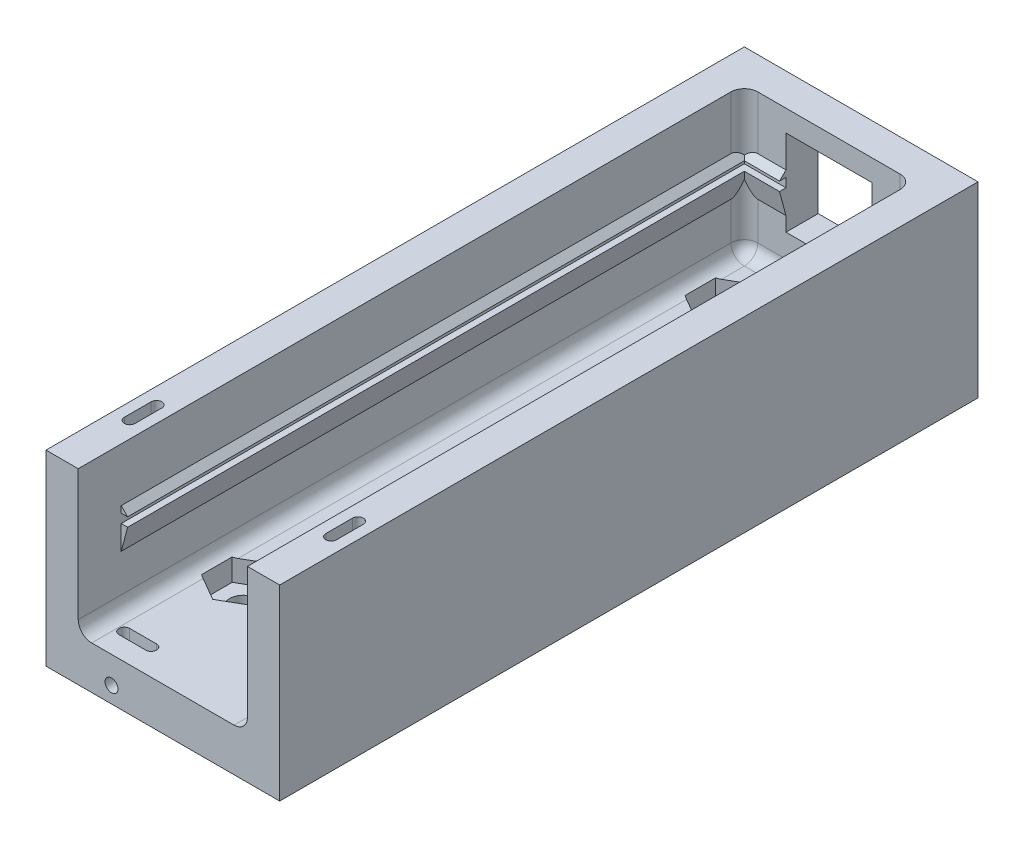
from build123d import *

# Parameters (mm, degrees)
BOSS_EXTRUDE1_DEPTH            = 82.55
BOSS_EXTRUDE2_START            = -5.08
BOSS_EXTRUDE2_DEPTH            = 77.47
BOSS_EXTRUDE4_REACH            = 89.467
SKETCH8_W                      = 27.6225
SKETCH8_H                      = 3.81
BOSS_EXTRUDE5_REACH            = 88.945
CUT_EXTRUDE1_REACH             = 86.753
SKETCH10_W                     = 10.16
SKETCH10_H                     = 10.16
SKETCH11_W                     = 27.6225
SKETCH11_H                     = 3.2766
CUT_EXTRUDE2_DEPTH             = 85.753025619
FILLET3_R                      = 1.5875
CUT_EXTRUDE3_DEPTH             = 2.286
CUT_EXTRUDE4_DEPTH             = 3.175
F_4_CLEARANCE_HOLE1_D          = 3.2639
CUT_EXTRUDE5_DEPTH             = 2.54
CUT_EXTRUDE5_DIRECTION_2_REACH = 87.415
SKETCH18_R                     = 0.762
CUT_EXTRUDE6_DEPTH             = 10.16


with BuildPart() as part:
    # Sketch1 → Boss-Extrude1 (new body)
    with BuildSketch(Plane.XY):
        Polygon((10.00125, 12.065), (10.00125, -8.255), (-10.00125, -8.255), (-10.00125, 12.065), (-13.81125, 12.065), (-13.81125, -13.335), (13.81125, -13.335), (13.81125, 12.065), align=None)
    extrude(amount=BOSS_EXTRUDE1_DEPTH)

    # Sketch3 → Boss-Extrude2 (add)
    with BuildSketch(Plane.XY.offset(82.55).offset(BOSS_EXTRUDE2_START)):
        Polygon((10.00125, 1.7018), (9.23925, 1.7018), (10.00125, 2.4638), align=None)
        Polygon((10.00125, 0.635), (9.23925, 0.635), (10.00125, -2.208822715), align=None)
        Polygon((-10.00125, 2.4638), (-10.00125, 1.7018), (-9.23925, 1.7018), align=None)
        Polygon((-10.00125, -2.208822715), (-10.00125, 0.635), (-9.23925, 0.635), align=None)
    extrude(amount=-BOSS_EXTRUDE2_DEPTH)

    # Boss-Extrude4: up to this face of the body (flat: up to its plane)
    boss_extrude4_end = Plane(part.part.faces().sort_by_distance((0, -8.255, 41.275))[0])
    # Sketch8 → Boss-Extrude4 (add, up to the picked face)
    with BuildSketch(Plane(origin=(0, 12.065, 0), x_dir=(1, 0, 0), z_dir=(0, 1, 0)), mode=Mode.PRIVATE) as boss_extrude4_sk1:
        with Locations((0, -1.905)):
            Rectangle(SKETCH8_W, SKETCH8_H)
    boss_extrude4_tool1 = split(extrude(boss_extrude4_sk1.sketch, amount=-BOSS_EXTRUDE4_REACH, mode=Mode.PRIVATE), bisect_by=boss_extrude4_end, keep=Keep.BOTH, mode=Mode.PRIVATE)
    add(boss_extrude4_tool1.solids().sort_by(Axis((0, 12.065, 1.905), (0, -1, 0)))[0])

    # Boss-Extrude5: up to this face of the body (flat: up to its plane)
    boss_extrude5_end = Plane(part.part.faces().sort_by_distance((10.00125, 7.2644, 4.623196778))[0])
    # Sketch9 → Boss-Extrude5 (add, up to the picked face)
    with BuildSketch(Plane(origin=(-10.00125, 0, 0), x_dir=(0, 0, -1), z_dir=(1, 0, 0)), mode=Mode.PRIVATE) as boss_extrude5_sk1:
        Polygon((-3.81, 2.4638), (-3.81, 1.7018), (-4.572, 1.7018), align=None)
    boss_extrude5_tool1 = split(extrude(boss_extrude5_sk1.sketch, amount=BOSS_EXTRUDE5_REACH, mode=Mode.PRIVATE), bisect_by=boss_extrude5_end, keep=Keep.BOTH, mode=Mode.PRIVATE)
    # Sketch9 → Boss-Extrude5 (add, up to the picked face)
    with BuildSketch(Plane(origin=(-10.00125, 0, 0), x_dir=(0, 0, -1), z_dir=(1, 0, 0)), mode=Mode.PRIVATE) as boss_extrude5_sk2:
        Polygon((-3.81, 0.635), (-3.81, -2.208822715), (-4.572, 0.635), align=None)
    boss_extrude5_tool2 = split(extrude(boss_extrude5_sk2.sketch, amount=BOSS_EXTRUDE5_REACH, mode=Mode.PRIVATE), bisect_by=boss_extrude5_end, keep=Keep.BOTH, mode=Mode.PRIVATE)
    add(boss_extrude5_tool1.solids().sort_by(Axis((-10.00125, 1.9558, 4.064), (1, 0, 0)))[0])
    add(boss_extrude5_tool2.solids().sort_by(Axis((-10.00125, -0.312941, 4.064), (1, 0, 0)))[0])

    # Sketch10 → Cut-Extrude1 (cut, up to next)
    with BuildSketch(Plane(origin=(0, 0, 0), x_dir=(-1, 0, 0), z_dir=(0, 0, -1)), mode=Mode.PRIVATE) as cut_extrude1_sk1:
        with Locations((0, 1.1684)):
            Rectangle(SKETCH10_W, SKETCH10_H)
    cut_extrude1_tool1 = extrude(cut_extrude1_sk1.sketch, amount=-CUT_EXTRUDE1_REACH, mode=Mode.PRIVATE) & part.part
    add(cut_extrude1_tool1.solids().sort_by_distance((0, 1.1684, 0))[0], mode=Mode.SUBTRACT)

    # Sketch11 → Cut-Extrude2 (cut, through all)
    with BuildSketch(Plane.XY.offset(82.55)):
        with Locations((0, 10.4267)):
            Rectangle(SKETCH11_W, SKETCH11_H)
    extrude(amount=-CUT_EXTRUDE2_DEPTH, mode=Mode.SUBTRACT)

    # Fillet3
    fillet3_edges = [part.edges().sort_by_distance(p)[0] for p in [
        (-10.00125, -8.255, 43.18),
        (10.00125, -8.255, 43.18),
        (10.00125, 5.6261, 3.81),
        (0, -8.255, 3.81),
        (10.00125, -5.231911358, 3.81),
        (-10.00125, 5.6261, 3.81),
        (-10.00125, -5.231911358, 3.81),
    ]]
    fillet(fillet3_edges, radius=FILLET3_R)

    # Sketch13 → Cut-Extrude3 (cut)
    with BuildSketch(Plane(origin=(0, -8.255, 0), x_dir=(1, 0, 0), z_dir=(0, 1, 0))):
        with BuildLine():
            Line((-7.651886934, -78.8162), (-4.476886934, -78.8162))
            ThreePointArc((-4.476886934, -78.8162), (-3.841886934, -79.4512), (-4.476886934, -80.0862))
            Line((-4.476886934, -80.0862), (-7.651886934, -80.0862))
            ThreePointArc((-7.651886934, -80.0862), (-8.286886934, -79.4512), (-7.651886934, -78.8162))
        make_face()
    extrude(amount=-CUT_EXTRUDE3_DEPTH, mode=Mode.SUBTRACT)

    # Sketch14 → Cut-Extrude4 (cut)
    with BuildSketch(Plane(origin=(0, 8.7884, 0), x_dir=(1, 0, 0), z_dir=(0, 1, 0))):
        with BuildLine():
            Line((-11.27125, -71.386954), (-11.27125, -74.561954))
            ThreePointArc((-11.27125, -74.561954), (-11.90625, -75.196954), (-12.54125, -74.561954))
            Line((-12.54125, -74.561954), (-12.54125, -71.386954))
            ThreePointArc((-12.54125, -71.386954), (-11.90625, -70.751954), (-11.27125, -71.386954))
        make_face()
        with BuildLine():
            Line((11.27125, -71.386954), (11.27125, -74.561954))
            ThreePointArc((11.27125, -74.561954), (11.90625, -75.196954), (12.54125, -74.561954))
            Line((12.54125, -74.561954), (12.54125, -71.386954))
            ThreePointArc((12.54125, -71.386954), (11.90625, -70.751954), (11.27125, -71.386954))
        make_face()
    extrude(amount=-CUT_EXTRUDE4_DEPTH, mode=Mode.SUBTRACT)

    # #4 Clearance Hole1 (through all)
    with Locations(Plane(origin=(0, -8.255, 0), x_dir=(1, 0, 0), z_dir=(0, 1, 0))):
        with Locations((-5.715, -10.16), (5.715, -67.31), (-5.715, -67.31), (5.715, -10.16)):
            Hole(F_4_CLEARANCE_HOLE1_D / 2)

    # Sketch17 → Cut-Extrude5 (cut)
    with BuildSketch(Plane(origin=(0, -8.255, 0), x_dir=(1, 0, 0), z_dir=(0, 1, 0))):
        Polygon((-5.715, -13.782180119), (-2.5781, -11.971090059), (-2.5781, -8.348909941), (-5.715, -6.537819881), (-8.8519, -8.348909941), (-8.8519, -11.971090059), align=None)
        Polygon((5.715, -13.782180119), (8.8519, -11.971090059), (8.8519, -8.348909941), (5.715, -6.537819881), (2.5781, -8.348909941), (2.5781, -11.971090059), align=None)
        Polygon((-5.715, -63.687819881), (-8.8519, -65.498909941), (-8.8519, -69.121090059), (-5.715, -70.932180119), (-2.5781, -69.121090059), (-2.5781, -65.498909941), align=None)
        Polygon((5.715, -63.687819881), (2.5781, -65.498909941), (2.5781, -69.121090059), (5.715, -70.932180119), (8.8519, -69.121090059), (8.8519, -65.498909941), align=None)
    extrude(amount=-CUT_EXTRUDE5_DEPTH, mode=Mode.SUBTRACT)

    # Sketch17 → Cut-Extrude5 direction 2 (cut, up to next)
    with BuildSketch(Plane(origin=(0, -8.255, 0), x_dir=(1, 0, 0), z_dir=(0, 1, 0)), mode=Mode.PRIVATE) as cut_extrude5_direction_2_sk1:
        Polygon((-5.715, -13.782180119), (-2.5781, -11.971090059), (-2.5781, -8.348909941), (-5.715, -6.537819881), (-8.8519, -8.348909941), (-8.8519, -11.971090059), align=None)
    cut_extrude5_direction_2_tool1 = extrude(cut_extrude5_direction_2_sk1.sketch, amount=CUT_EXTRUDE5_DIRECTION_2_REACH, mode=Mode.PRIVATE) & part.part
    # Sketch17 → Cut-Extrude5 direction 2 (cut, up to next)
    with BuildSketch(Plane(origin=(0, -8.255, 0), x_dir=(1, 0, 0), z_dir=(0, 1, 0)), mode=Mode.PRIVATE) as cut_extrude5_direction_2_sk2:
        Polygon((5.715, -13.782180119), (8.8519, -11.971090059), (8.8519, -8.348909941), (5.715, -6.537819881), (2.5781, -8.348909941), (2.5781, -11.971090059), align=None)
    cut_extrude5_direction_2_tool2 = extrude(cut_extrude5_direction_2_sk2.sketch, amount=CUT_EXTRUDE5_DIRECTION_2_REACH, mode=Mode.PRIVATE) & part.part
    # Sketch17 → Cut-Extrude5 direction 2 (cut, up to next)
    with BuildSketch(Plane(origin=(0, -8.255, 0), x_dir=(1, 0, 0), z_dir=(0, 1, 0)), mode=Mode.PRIVATE) as cut_extrude5_direction_2_sk3:
        Polygon((-5.715, -63.687819881), (-8.8519, -65.498909941), (-8.8519, -69.121090059), (-5.715, -70.932180119), (-2.5781, -69.121090059), (-2.5781, -65.498909941), align=None)
    cut_extrude5_direction_2_tool3 = extrude(cut_extrude5_direction_2_sk3.sketch, amount=CUT_EXTRUDE5_DIRECTION_2_REACH, mode=Mode.PRIVATE) & part.part
    # Sketch17 → Cut-Extrude5 direction 2 (cut, up to next)
    with BuildSketch(Plane(origin=(0, -8.255, 0), x_dir=(1, 0, 0), z_dir=(0, 1, 0)), mode=Mode.PRIVATE) as cut_extrude5_direction_2_sk4:
        Polygon((5.715, -63.687819881), (2.5781, -65.498909941), (2.5781, -69.121090059), (5.715, -70.932180119), (8.8519, -69.121090059), (8.8519, -65.498909941), align=None)
    cut_extrude5_direction_2_tool4 = extrude(cut_extrude5_direction_2_sk4.sketch, amount=CUT_EXTRUDE5_DIRECTION_2_REACH, mode=Mode.PRIVATE) & part.part
    add(cut_extrude5_direction_2_tool1.solids().sort_by_distance((-5.715, -8.255, 10.16))[0], mode=Mode.SUBTRACT)
    add(cut_extrude5_direction_2_tool2.solids().sort_by_distance((5.715, -8.255, 10.16))[0], mode=Mode.SUBTRACT)
    add(cut_extrude5_direction_2_tool3.solids().sort_by_distance((-5.715, -8.255, 67.31))[0], mode=Mode.SUBTRACT)
    add(cut_extrude5_direction_2_tool4.solids().sort_by_distance((5.715, -8.255, 67.31))[0], mode=Mode.SUBTRACT)

    # Sketch18 → Cut-Extrude6 (cut)
    with BuildSketch(Plane.XY.offset(82.55)):
        with Locations((-6.064467422, -11.430018288)):
            Circle(SKETCH18_R)
    extrude(amount=-CUT_EXTRUDE6_DEPTH, mode=Mode.SUBTRACT)


solid = part.part
